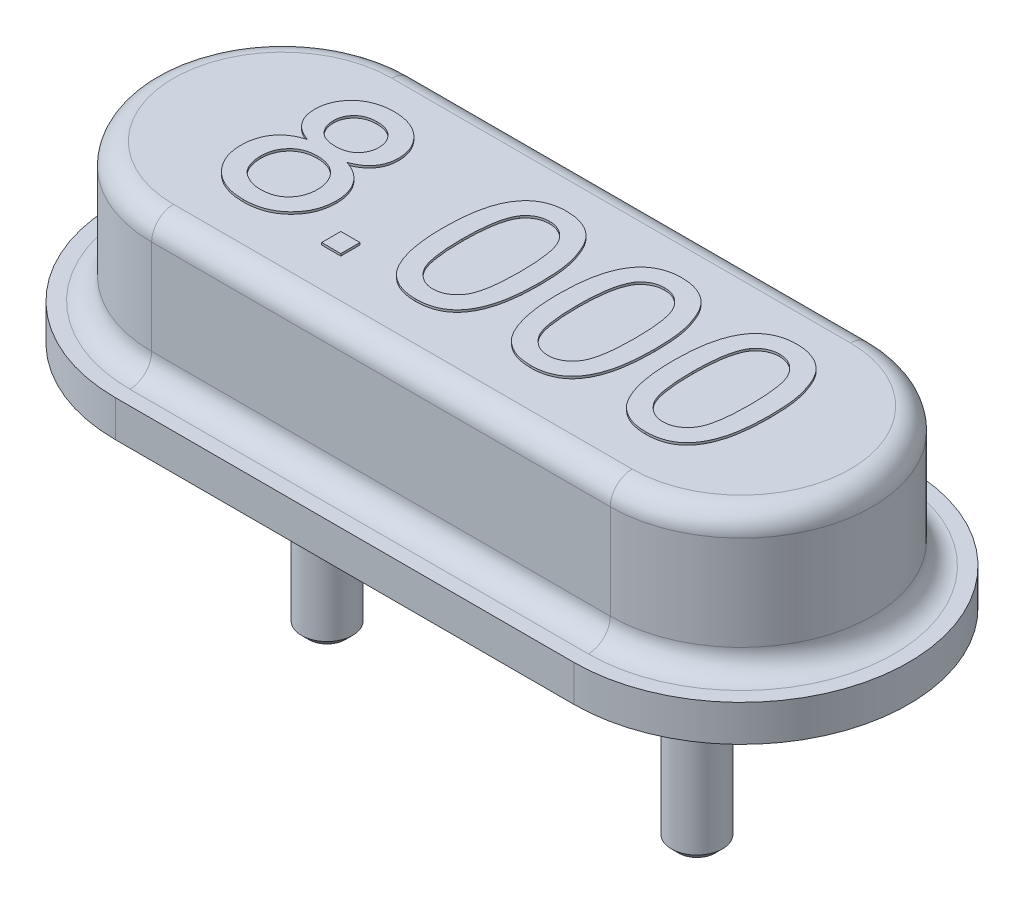
from build123d import *

# Parameters (mm, degrees)
BOSS_EXTRUDE1_DEPTH = 0.5
BOSS_EXTRUDE2_DEPTH = 1.9
FILLET1_R           = 0.3
SKETCH3_W           = 0.263417301
SKETCH3_H           = 0.263417301
BOSS_EXTRUDE3_DEPTH = 0.03
SKETCH4_R           = 0.35
BOSS_EXTRUDE4_DEPTH = 3.1
CHAMFER1_SIZE       = 0.1


with BuildPart() as part:
    # Sketch1 → Boss-Extrude1 (new body)
    with BuildSketch(Plane(origin=(0, 0, 0), x_dir=(1, 0, 0), z_dir=(0, 1, 0))):
        with BuildLine():
            Line((-3.15, 2.3), (3.15, 2.3))
            ThreePointArc((3.15, 2.3), (5.45, 0), (3.15, -2.3))
            Line((3.15, -2.3), (-3.15, -2.3))
            ThreePointArc((-3.15, -2.3), (-5.45, 0), (-3.15, 2.3))
        make_face()
    extrude(amount=BOSS_EXTRUDE1_DEPTH)

    # Sketch2 → Boss-Extrude2 (add)
    with BuildSketch(Plane(origin=(0, 0.5, 0), x_dir=(1, 0, 0), z_dir=(0, 1, 0))):
        with BuildLine():
            Line((-3.15, -1.8), (3.15, -1.8))
            ThreePointArc((3.15, -1.8), (4.95, 0), (3.15, 1.8))
            Line((3.15, 1.8), (-3.15, 1.8))
            ThreePointArc((-3.15, 1.8), (-4.95, 0), (-3.15, -1.8))
        make_face()
    extrude(amount=BOSS_EXTRUDE2_DEPTH)

    # Fillet1
    fillet1_edges = [part.edges().sort_by_distance(p)[0] for p in [
        (-4.95, 0.5, 0),
        (0, 0.5, 1.8),
        (4.95, 0.5, 0),
        (0, 0.5, -1.8),
        (-4.95, 2.4, 0),
        (0, 2.4, 1.8),
        (4.95, 2.4, 0),
        (0, 2.4, -1.8),
    ]]
    fillet(fillet1_edges, radius=FILLET1_R)

    # Sketch3 → Boss-Extrude3 (add)
    # profile 1 of 5: a face of its own
    with BuildSketch(Plane(origin=(0, 2.4, 0), x_dir=(1, 0, 0), z_dir=(0, 1, 0))):
        with BuildLine():
            add(Edge.make_bspline(
                [(-2.969967632, 0.159673879), (-2.994961282, 0.169451537), (-3.042882398, 0.188198548), (-3.107515629, 0.225716596), (-3.162217327, 0.268876169), (-3.206315829, 0.318718033), (-3.239926905, 0.374211819), (-3.264128208, 0.434649984), (-3.278303336, 0.500369235), (-3.280168947, 0.545812404), (-3.281129319, 0.569205464)],
                knots=[0, 0, 0, 0, 1.16287356, 2.229614231, 3.228817875, 4.173350329, 5.100165549, 6.029633206, 6.985702163, 8, 8, 8, 8], degree=3))
            add(Edge.make_bspline(
                [(-3.281129319, 0.569205464), (-3.280677316, 0.587205392), (-3.279790022, 0.622539814), (-3.272123594, 0.674387095), (-3.259844705, 0.724069762), (-3.242418089, 0.77144759), (-3.220585395, 0.816910542), (-3.193036217, 0.859625717), (-3.161370148, 0.900800332), (-3.124274853, 0.938769983), (-3.083396479, 0.973546509), (-3.03911882, 1.004494201), (-2.991103064, 1.02980189), (-2.94014977, 1.05096125), (-2.886006999, 1.067526792), (-2.82848403, 1.078808849), (-2.767783646, 1.085985074), (-2.726190301, 1.08691882), (-2.704903973, 1.087396686)],
                knots=[0, 0, 0, 0, 0.994101948, 1.951453197, 2.889123786, 3.817215529, 4.736003873, 5.669743943, 6.620499649, 7.601567446, 8.596478358, 9.582687259, 10.579761808, 11.589151689, 12.62747492, 13.702346593, 14.8241243, 16, 16, 16, 16], degree=3))
            add(Edge.make_bspline(
                [(-2.704903973, 1.087396686), (-2.683482006, 1.086913969), (-2.641754433, 1.085973689), (-2.580731559, 1.078893885), (-2.522845583, 1.067027692), (-2.468130585, 1.05019255), (-2.416500306, 1.028667809), (-2.368294006, 1.002211076), (-2.323015432, 0.971258707), (-2.281821888, 0.935441584), (-2.244340673, 0.896555837), (-2.211866741, 0.85489604), (-2.184014883, 0.811434295), (-2.160999507, 0.765906564), (-2.143972645, 0.717794407), (-2.130994354, 0.66800428), (-2.123466343, 0.615944578), (-2.122556621, 0.580616651), (-2.122093194, 0.562620032)],
                knots=[0, 0, 0, 0, 1.171211919, 2.281388661, 3.353996503, 4.398126828, 5.406889753, 6.407389155, 7.400009931, 8.40008733, 9.387021643, 10.349004252, 11.283445052, 12.206096336, 13.131640667, 14.068727932, 15.016178647, 16, 16, 16, 16], degree=3))
            add(Edge.make_bspline(
                [(-2.122093194, 0.562620032), (-2.122846017, 0.54003323), (-2.124322162, 0.49574476), (-2.139364737, 0.431902562), (-2.162809877, 0.37230267), (-2.196695179, 0.318080956), (-2.239609654, 0.268677429), (-2.292863095, 0.225730401), (-2.355646752, 0.188270988), (-2.402357935, 0.169462849), (-2.426669448, 0.159673879)],
                knots=[0, 0, 0, 0, 0.998680737, 1.958225066, 2.887911823, 3.823713378, 4.77537694, 5.772726054, 6.840782926, 8, 8, 8, 8], degree=3))
            add(Edge.make_bspline(
                [(-2.426669448, 0.159673879), (-2.411330462, 0.15446702), (-2.381272702, 0.144263835), (-2.338779999, 0.124425699), (-2.298774395, 0.103035479), (-2.261030296, 0.079880553), (-2.226940929, 0.053238945), (-2.195368973, 0.024685861), (-2.16644717, -0.006181066), (-2.140570561, -0.039624364), (-2.11746802, -0.074942114), (-2.09769041, -0.112220423), (-2.080893667, -0.150928684), (-2.066538591, -0.191246393), (-2.056053343, -0.233457543), (-2.048716956, -0.277368153), (-2.044062225, -0.322746798), (-2.043402857, -0.353566983), (-2.043068004, -0.369218671)],
                knots=[0, 0, 0, 0, 1.104208047, 2.163768705, 3.193778962, 4.198696312, 5.179575955, 6.14024585, 7.100368562, 8.060719304, 9.021161243, 9.975749006, 10.935506756, 11.897452199, 12.89163552, 13.897859372, 14.932451246, 16, 16, 16, 16], degree=3))
            add(Edge.make_bspline(
                [(-2.043068004, -0.369218671), (-2.04359149, -0.390790937), (-2.044622796, -0.433289945), (-2.053684181, -0.495673501), (-2.067394456, -0.555601419), (-2.087385621, -0.612820541), (-2.112919306, -0.667371316), (-2.144504782, -0.719174531), (-2.181831712, -0.768176896), (-2.223799017, -0.814530726), (-2.270718438, -0.856432581), (-2.321476561, -0.893357361), (-2.376263836, -0.924286572), (-2.434415507, -0.949895847), (-2.496210023, -0.969742941), (-2.561567952, -0.983640114), (-2.630467546, -0.99191527), (-2.677578954, -0.993030894), (-2.701611256, -0.993599992)],
                knots=[0, 0, 0, 0, 1.017598406, 2.004746413, 2.969099523, 3.915171376, 4.859468899, 5.806714415, 6.772805022, 7.762836953, 8.753334612, 9.736396794, 10.719437652, 11.716790048, 12.730404696, 13.776887535, 14.865953843, 16, 16, 16, 16], degree=3))
            add(Edge.make_bspline(
                [(-2.701611256, -0.993599992), (-2.725641155, -0.993018629), (-2.772747851, -0.991878962), (-2.841710394, -0.98377298), (-2.906974813, -0.96924581), (-2.968688981, -0.949378542), (-3.027187678, -0.924462641), (-3.081607005, -0.892836516), (-3.132696679, -0.855958518), (-3.179648725, -0.813797488), (-3.22196463, -0.767448602), (-3.258799509, -0.717722548), (-3.290197479, -0.665384594), (-3.316037327, -0.610139698), (-3.335733183, -0.551987357), (-3.349555969, -0.491145896), (-3.358633755, -0.427661806), (-3.359640448, -0.384342403), (-3.360154509, -0.362221649)],
                knots=[0, 0, 0, 0, 1.127066097, 2.209429196, 3.250843736, 4.258219581, 5.246860502, 6.227045772, 7.204057202, 8.19754525, 9.181483529, 10.142920909, 11.095356922, 12.039670968, 12.998174893, 13.969127444, 14.962948905, 16, 16, 16, 16], degree=3))
            add(Edge.make_bspline(
                [(-3.360154509, -0.362221649), (-3.359797198, -0.345751101), (-3.359096092, -0.313433035), (-3.354813271, -0.266031228), (-3.346277693, -0.220852323), (-3.335283324, -0.177630082), (-3.321323915, -0.136256374), (-3.304102328, -0.097056107), (-3.283208106, -0.060124024), (-3.259470899, -0.02521981), (-3.232591172, 0.007411496), (-3.203004583, 0.037484133), (-3.170603658, 0.064656047), (-3.136116506, 0.089720845), (-3.098097548, 0.110905518), (-3.057960697, 0.130346402), (-3.015015894, 0.146925871), (-2.985134106, 0.155381986), (-2.969967632, 0.159673879)],
                knots=[0, 0, 0, 0, 1.117345089, 2.192424383, 3.22371675, 4.232639188, 5.215561493, 6.182180952, 7.132172269, 8.089790513, 9.041830748, 9.996006267, 10.94686322, 11.907506267, 12.882866327, 13.894317773, 14.931262935, 16, 16, 16, 16], degree=3))
        make_face()
        with BuildLine():
            add(Edge.make_bspline(
                [(-3.017712018, 0.567970696), (-3.016930198, 0.547000832), (-3.015419376, 0.506477752), (-2.998989022, 0.448917685), (-2.973296718, 0.397212604), (-2.943176999, 0.359717276), (-2.914299754, 0.33416977), (-2.890197716, 0.317112608), (-2.863858849, 0.302631421), (-2.83509234, 0.29137573), (-2.804594916, 0.281403888), (-2.771314764, 0.275830354), (-2.736034113, 0.271299402), (-2.711643777, 0.270971255), (-2.699141719, 0.270803053)],
                knots=[0, 0, 0, 0, 1.528727296, 2.954179336, 4.335216052, 5.725683216, 6.435919001, 7.148062981, 7.879427438, 8.626027458, 9.402978632, 10.2190538, 11.08711833, 12, 12, 12, 12], degree=3))
            add(Edge.make_bspline(
                [(-2.699141719, 0.270803053), (-2.686915633, 0.27097747), (-2.663075435, 0.271317575), (-2.628589388, 0.275756155), (-2.596000195, 0.281684296), (-2.565789426, 0.290667482), (-2.537608302, 0.302348243), (-2.511915175, 0.316747739), (-2.487941183, 0.333296892), (-2.459912244, 0.35903958), (-2.42983409, 0.395221674), (-2.404055684, 0.444617015), (-2.387991679, 0.498658452), (-2.386352076, 0.536301463), (-2.385510495, 0.55562301)],
                knots=[0, 0, 0, 0, 0.922112375, 1.798068639, 2.620552757, 3.419964248, 4.17189205, 4.918165909, 5.639229138, 6.36503528, 7.785020832, 9.165298717, 10.544993853, 12, 12, 12, 12], degree=3))
            add(Edge.make_bspline(
                [(-2.385510495, 0.55562301), (-2.386524482, 0.575619983), (-2.388508593, 0.614748881), (-2.404533359, 0.670920178), (-2.431512455, 0.721794597), (-2.462332333, 0.758947465), (-2.490857103, 0.78586253), (-2.515261498, 0.802995772), (-2.541496314, 0.817577676), (-2.5696614, 0.829485764), (-2.599797484, 0.839089761), (-2.631986202, 0.845390446), (-2.666092297, 0.849809338), (-2.68952248, 0.850146933), (-2.701611256, 0.850321115)],
                knots=[0, 0, 0, 0, 1.480633456, 2.897216237, 4.289382554, 5.720567045, 6.454675042, 7.191244726, 7.924224627, 8.676083236, 9.454506446, 10.26432127, 11.104478565, 12, 12, 12, 12], degree=3))
            add(Edge.make_bspline(
                [(-2.701611256, 0.850321115), (-2.713701378, 0.850152566), (-2.737270479, 0.849823989), (-2.77159897, 0.845272495), (-2.80409274, 0.839555911), (-2.834452014, 0.830381852), (-2.862550599, 0.818393489), (-2.888681984, 0.803803394), (-2.913040139, 0.787107794), (-2.941765315, 0.761392915), (-2.971850204, 0.725210002), (-2.998354146, 0.676603562), (-3.014734439, 0.623606139), (-3.016707198, 0.586745545), (-3.017712018, 0.567970696)],
                knots=[0, 0, 0, 0, 0.914830409, 1.783417199, 2.618873138, 3.411020283, 4.179090249, 4.927874451, 5.674348476, 6.410336976, 7.841713217, 9.213201474, 10.580551314, 12, 12, 12, 12], degree=3))
        make_face(mode=Mode.SUBTRACT)
        with BuildLine():
            add(Edge.make_bspline(
                [(-3.096737208, -0.357282574), (-3.0962817, -0.374184871), (-3.095369484, -0.408033988), (-3.087367388, -0.4583071), (-3.07378949, -0.507644034), (-3.056387048, -0.556091393), (-3.031839823, -0.601693757), (-2.999287441, -0.642397223), (-2.958440299, -0.676618242), (-2.91179063, -0.705529458), (-2.860883846, -0.728285071), (-2.807837489, -0.744169263), (-2.754020657, -0.754664743), (-2.717711169, -0.755904458), (-2.699553309, -0.756524421)],
                knots=[0, 0, 0, 0, 0.957879255, 1.91828174, 2.876792425, 3.856375228, 4.831004356, 5.799187063, 6.79220414, 7.836856316, 8.902268238, 9.943090861, 10.971368942, 12, 12, 12, 12], degree=3))
            add(Edge.make_bspline(
                [(-2.699553309, -0.756524421), (-2.684580195, -0.756270788), (-2.655491704, -0.75577805), (-2.613089792, -0.750147464), (-2.573137604, -0.741604023), (-2.535452101, -0.729889566), (-2.500587973, -0.713863412), (-2.467977471, -0.69513232), (-2.437954158, -0.672494362), (-2.410526534, -0.646658736), (-2.385973949, -0.618079693), (-2.364941554, -0.58724915), (-2.346594748, -0.555034141), (-2.33161542, -0.520739415), (-2.320782951, -0.484294255), (-2.312424172, -0.44635621), (-2.307381567, -0.40653397), (-2.306788389, -0.379385734), (-2.306485305, -0.365514365)],
                knots=[0, 0, 0, 0, 1.149387474, 2.232932207, 3.278773642, 4.285224938, 5.256757121, 6.220082341, 7.168479488, 8.137608443, 9.109140627, 10.056190326, 10.999892409, 11.953252726, 12.923240661, 13.915357002, 14.934853301, 16, 16, 16, 16], degree=3))
            add(Edge.make_bspline(
                [(-2.306485305, -0.365514365), (-2.306798042, -0.351370717), (-2.30741033, -0.323679707), (-2.312324786, -0.282983451), (-2.321152272, -0.244377942), (-2.332504456, -0.207279964), (-2.347889911, -0.172334915), (-2.366357996, -0.139041726), (-2.388973898, -0.10827793), (-2.413774038, -0.078999091), (-2.441839491, -0.052494974), (-2.472832536, -0.029639473), (-2.505770933, -0.009454195), (-2.541651098, 0.006029618), (-2.579682542, 0.018432504), (-2.620045946, 0.027444631), (-2.662905885, 0.032953504), (-2.692264752, 0.033464507), (-2.70737351, 0.033727482)],
                knots=[0, 0, 0, 0, 1.065858887, 2.086781919, 3.082735321, 4.047496077, 5.006086125, 5.955204095, 6.910833714, 7.878747924, 8.844339535, 9.812198509, 10.776903849, 11.749116737, 12.749729282, 13.788304076, 14.861809717, 16, 16, 16, 16], degree=3))
            add(Edge.make_bspline(
                [(-2.70737351, 0.033727482), (-2.722071979, 0.03346189), (-2.750885556, 0.032941249), (-2.792743718, 0.02740117), (-2.832370538, 0.018893448), (-2.869417377, 0.006441263), (-2.904347434, -0.009119007), (-2.936521851, -0.028684933), (-2.966514618, -0.051395391), (-2.993409562, -0.077791978), (-3.017675771, -0.106465848), (-3.038656508, -0.137204149), (-3.057190862, -0.169293844), (-3.071256192, -0.203787912), (-3.083161235, -0.239571225), (-3.09060377, -0.277338296), (-3.095894482, -0.316660026), (-3.096452194, -0.343543813), (-3.096737208, -0.357282574)],
                knots=[0, 0, 0, 0, 1.135239447, 2.225422834, 3.256957183, 4.262780498, 5.240265059, 6.205773948, 7.16638056, 8.141101257, 9.111719309, 10.064571387, 11.014055337, 11.969087385, 12.938082716, 13.92369833, 14.938921288, 16, 16, 16, 16], degree=3))
        make_face(mode=Mode.SUBTRACT)
    # profile 2 of 5: a face of its own
    with BuildSketch(Plane(origin=(0, 2.4, 0), x_dir=(1, 0, 0), z_dir=(0, 1, 0))):
        with Locations((-1.516233402, -0.835549612)):
            Rectangle(SKETCH3_W, SKETCH3_H)
    # profile 3 of 5: a face of its own
    with BuildSketch(Plane(origin=(0, 2.4, 0), x_dir=(1, 0, 0), z_dir=(0, 1, 0))):
        with BuildLine():
            add(Edge.make_bspline(
                [(-0.9893988, 0.046075168), (-0.989133407, 0.075438073), (-0.988613614, 0.132947639), (-0.985389506, 0.217094466), (-0.979760475, 0.297005223), (-0.971357882, 0.372610512), (-0.961407637, 0.444080988), (-0.948472255, 0.511314656), (-0.933918071, 0.574462366), (-0.916455662, 0.633458296), (-0.89727019, 0.688809703), (-0.875503661, 0.740427793), (-0.851013363, 0.788257836), (-0.825002842, 0.832795859), (-0.79610285, 0.87334911), (-0.766057735, 0.911055681), (-0.732683995, 0.944532724), (-0.697369382, 0.974641607), (-0.65959388, 1.001210941), (-0.619557359, 1.024137072), (-0.577413868, 1.044379193), (-0.532360199, 1.059617456), (-0.485331657, 1.072039871), (-0.435966241, 1.08117795), (-0.384209552, 1.086565156), (-0.34884113, 1.087116378), (-0.330855547, 1.087396686)],
                knots=[0, 0, 0, 0, 1.514747001, 2.966751498, 4.343369068, 5.64627492, 6.890416844, 8.064737671, 9.177176366, 10.232018008, 11.237056675, 12.19799043, 13.119080079, 14.007588942, 14.855863561, 15.685992447, 16.491747269, 17.290132607, 18.077525251, 18.870243746, 19.668095604, 20.485086593, 21.319398728, 22.175900658, 23.072407314, 24, 24, 24, 24], degree=3))
            add(Edge.make_bspline(
                [(-0.330855547, 1.087396686), (-0.304468358, 1.086620921), (-0.252629667, 1.0850969), (-0.17694491, 1.072667263), (-0.105616904, 1.051404453), (-0.038691991, 1.022720004), (0.022685758, 0.986285233), (0.077498675, 0.941993219), (0.125155514, 0.890309017), (0.165136174, 0.830620189), (0.200083261, 0.764573349), (0.231129487, 0.691872055), (0.259194373, 0.612597778), (0.279109827, 0.541636234), (0.293315505, 0.48037971), (0.302718534, 0.429857063), (0.310524934, 0.375342842), (0.316505691, 0.316968931), (0.321412761, 0.254800804), (0.325202266, 0.188799752), (0.327125828, 0.118800816), (0.327496902, 0.070771508), (0.327687705, 0.046075168)],
                knots=[0, 0, 0, 0, 1.134486744, 2.228744715, 3.287356444, 4.328707449, 5.352829806, 6.347195599, 7.349461267, 8.364207941, 9.428085653, 10.559314403, 11.761222316, 13.04268526, 13.726896727, 14.465273606, 15.252205015, 16.094778733, 16.988606776, 17.934225168, 18.937792761, 20, 20, 20, 20], degree=3))
            add(Edge.make_bspline(
                [(0.327687705, 0.046075168), (0.327417341, 0.016850185), (0.326889131, -0.040246573), (0.323751415, -0.123718684), (0.317783196, -0.203026553), (0.310439192, -0.278351852), (0.299329254, -0.349493498), (0.287357693, -0.416753752), (0.27255183, -0.479827194), (0.255276864, -0.538741467), (0.235821329, -0.593808089), (0.214485324, -0.645443222), (0.19085365, -0.693611584), (0.164222939, -0.737843365), (0.135811667, -0.778725668), (0.105411751, -0.81641185), (0.072378678, -0.8503595), (0.036745826, -0.880378072), (-0.000764445, -0.907418576), (-0.040898302, -0.930571057), (-0.083480087, -0.949752486), (-0.128225294, -0.966151654), (-0.175587927, -0.978168003), (-0.22519449, -0.98736633), (-0.27722776, -0.992782971), (-0.312732984, -0.993323894), (-0.330855547, -0.993599992)],
                knots=[0, 0, 0, 0, 1.508974709, 2.94807912, 4.311757619, 5.615040294, 6.854280449, 8.028314546, 9.141715822, 10.197470207, 11.196696834, 12.155719058, 13.080757287, 13.963948316, 14.818758719, 15.649605906, 16.461113142, 17.260189315, 18.052359509, 18.845763934, 19.647754795, 20.461145776, 21.303032214, 22.167241874, 23.064524267, 24, 24, 24, 24], degree=3))
            add(Edge.make_bspline(
                [(-0.330855547, -0.993599992), (-0.354616329, -0.992922214), (-0.400943314, -0.991600735), (-0.46860046, -0.982622094), (-0.5321003, -0.966819265), (-0.591978419, -0.945625443), (-0.64756177, -0.917277486), (-0.699115743, -0.882786661), (-0.747676277, -0.842955432), (-0.775630673, -0.811529507), (-0.789777876, -0.795625427)],
                knots=[0, 0, 0, 0, 1.10322584, 2.150986741, 3.161425019, 4.136713905, 5.093944212, 6.049774532, 7.013026876, 8, 8, 8, 8], degree=3))
            add(Edge.make_bspline(
                [(-0.789777876, -0.795625427), (-0.806061633, -0.772135868), (-0.839639437, -0.723699394), (-0.878939345, -0.641110712), (-0.913995559, -0.550192168), (-0.941508259, -0.449159952), (-0.963057562, -0.338818167), (-0.978621539, -0.218950297), (-0.987429217, -0.089608129), (-0.988727452, -0.000173588), (-0.9893988, 0.046075168)],
                knots=[0, 0, 0, 0, 0.779365345, 1.607084704, 2.489375761, 3.438383567, 4.461919411, 5.557722155, 6.737039282, 8, 8, 8, 8], degree=3))
        make_face()
        with BuildLine():
            add(Edge.make_bspline(
                [(-0.725981499, 0.046898347), (-0.725719946, 0.007379859), (-0.725219277, -0.068267268), (-0.719988499, -0.17634224), (-0.71098393, -0.273840617), (-0.699079302, -0.360627407), (-0.683360373, -0.436820005), (-0.663623398, -0.502224249), (-0.641375133, -0.557625138), (-0.613843327, -0.602336022), (-0.58369904, -0.638781914), (-0.552577123, -0.670126561), (-0.519745387, -0.696768792), (-0.485418053, -0.71898298), (-0.449062509, -0.735802104), (-0.411076296, -0.747992642), (-0.371451148, -0.755008109), (-0.344464623, -0.7560161), (-0.330855547, -0.756524421)],
                knots=[0, 0, 0, 0, 1.89448813, 3.626469325, 5.185477471, 6.587276848, 7.82441448, 8.910550357, 9.859733512, 10.6775885, 11.416198291, 12.123144072, 12.791880183, 13.439617036, 14.078171869, 14.70637855, 15.347637704, 16, 16, 16, 16], degree=3))
            add(Edge.make_bspline(
                [(-0.330855547, -0.756524421), (-0.31724988, -0.756004993), (-0.290270112, -0.754974978), (-0.250553407, -0.748114208), (-0.21271499, -0.735296109), (-0.176413651, -0.718536391), (-0.141836816, -0.696828531), (-0.109166326, -0.670085666), (-0.077880466, -0.638759631), (-0.047871586, -0.601890121), (-0.020549534, -0.556972524), (0.002116081, -0.501616764), (0.021545466, -0.436097978), (0.037350649, -0.3599442), (0.049304385, -0.273294627), (0.058254511, -0.176066666), (0.063520295, -0.068130751), (0.064012701, 0.007379681), (0.064270404, 0.046898347)],
                knots=[0, 0, 0, 0, 0.652509534, 1.29391342, 1.924290653, 2.562989607, 3.207355802, 3.876242846, 4.583348185, 5.32723334, 6.150888545, 7.094226006, 8.186903555, 9.424320409, 10.81992305, 12.379283064, 14.105084285, 16, 16, 16, 16], degree=3))
            add(Edge.make_bspline(
                [(0.064270404, 0.046898347), (0.064020953, 0.085594758), (0.063543013, 0.159735616), (0.058141418, 0.265728521), (0.049676632, 0.361590428), (0.038098151, 0.447409712), (0.022710351, 0.523093205), (0.004047048, 0.588802026), (-0.018193067, 0.644396042), (-0.044636484, 0.690433694), (-0.074073299, 0.728197058), (-0.104822843, 0.760884536), (-0.137653857, 0.788684171), (-0.173148008, 0.810985448), (-0.210161254, 0.828977289), (-0.249544064, 0.841359732), (-0.290909336, 0.848967118), (-0.319297786, 0.849864626), (-0.333736674, 0.850321115)],
                knots=[0, 0, 0, 0, 1.850066095, 3.544656626, 5.0727657, 6.45041401, 7.682899467, 8.762389858, 9.712573485, 10.538438529, 11.291566246, 11.996865408, 12.681389046, 13.341983376, 13.996294293, 14.643563182, 15.31009126, 16, 16, 16, 16], degree=3))
            add(Edge.make_bspline(
                [(-0.333736674, 0.850321115), (-0.347344895, 0.849963953), (-0.374178562, 0.849259675), (-0.413466566, 0.84253735), (-0.450699345, 0.831296125), (-0.486303467, 0.816068793), (-0.519390095, 0.795575812), (-0.551271361, 0.771648799), (-0.580454071, 0.742496403), (-0.598039316, 0.720702528), (-0.607032124, 0.709557495)],
                knots=[0, 0, 0, 0, 1.021318143, 2.013908504, 2.982026795, 3.937174072, 4.91255697, 5.897578595, 6.924855925, 8, 8, 8, 8], degree=3))
            add(Edge.make_bspline(
                [(-0.607032124, 0.709557495), (-0.616822548, 0.693188893), (-0.637497863, 0.658621854), (-0.660632338, 0.598542914), (-0.681068419, 0.529884122), (-0.697894089, 0.451589112), (-0.710066281, 0.363792191), (-0.719675755, 0.266595319), (-0.72466752, 0.159862798), (-0.725531421, 0.085592072), (-0.725981499, 0.046898347)],
                knots=[0, 0, 0, 0, 0.671104906, 1.417232262, 2.260109084, 3.195198885, 4.23592645, 5.382417421, 6.636286093, 8, 8, 8, 8], degree=3))
        make_face(mode=Mode.SUBTRACT)
    # profile 4 of 5: a face of its own
    with BuildSketch(Plane(origin=(0, 2.4, 0), x_dir=(1, 0, 0), z_dir=(0, 1, 0))):
        with BuildLine():
            add(Edge.make_bspline(
                [(0.591105006, 0.046075168), (0.591370399, 0.075438073), (0.591890192, 0.132947639), (0.5951143, 0.217094466), (0.600743331, 0.297005223), (0.609145925, 0.372610512), (0.61909617, 0.444080988), (0.632031551, 0.511314656), (0.646585735, 0.574462366), (0.664048144, 0.633458296), (0.683233616, 0.688809703), (0.705000145, 0.740427793), (0.729490443, 0.788257836), (0.755500964, 0.832795859), (0.784400956, 0.87334911), (0.814446072, 0.911055681), (0.847819812, 0.944532724), (0.883134424, 0.974641607), (0.920909926, 1.001210941), (0.960946447, 1.024137072), (1.003089938, 1.044379193), (1.048143607, 1.059617456), (1.095172149, 1.072039871), (1.144537565, 1.08117795), (1.196294254, 1.086565156), (1.231662676, 1.087116378), (1.249648259, 1.087396686)],
                knots=[0, 0, 0, 0, 1.514747001, 2.966751498, 4.343369068, 5.64627492, 6.890416844, 8.064737671, 9.177176366, 10.232018008, 11.237056675, 12.19799043, 13.119080079, 14.007588942, 14.855863561, 15.685992447, 16.491747269, 17.290132607, 18.077525251, 18.870243746, 19.668095604, 20.485086593, 21.319398728, 22.175900658, 23.072407314, 24, 24, 24, 24], degree=3))
            add(Edge.make_bspline(
                [(1.249648259, 1.087396686), (1.276035448, 1.086620921), (1.327874139, 1.0850969), (1.403558897, 1.072667263), (1.474886902, 1.051404453), (1.541811815, 1.022720004), (1.603189564, 0.986285233), (1.658002481, 0.941993219), (1.70565932, 0.890309017), (1.74563998, 0.830620189), (1.780587068, 0.764573349), (1.811633293, 0.691872055), (1.839698179, 0.612597778), (1.859613633, 0.541636234), (1.873819311, 0.48037971), (1.88322234, 0.429857063), (1.89102874, 0.375342842), (1.897009497, 0.316968931), (1.901916567, 0.254800804), (1.905706072, 0.188799752), (1.907629634, 0.118800816), (1.908000708, 0.070771508), (1.908191511, 0.046075168)],
                knots=[0, 0, 0, 0, 1.134486744, 2.228744715, 3.287356444, 4.328707449, 5.352829806, 6.347195599, 7.349461267, 8.364207941, 9.428085653, 10.559314403, 11.761222316, 13.04268526, 13.726896727, 14.465273606, 15.252205015, 16.094778733, 16.988606776, 17.934225168, 18.937792761, 20, 20, 20, 20], degree=3))
            add(Edge.make_bspline(
                [(1.908191511, 0.046075168), (1.907921147, 0.016850185), (1.907392937, -0.040246573), (1.904255221, -0.123718684), (1.898287002, -0.203026553), (1.890942999, -0.278351852), (1.87983306, -0.349493498), (1.8678615, -0.416753752), (1.853055636, -0.479827194), (1.83578067, -0.538741467), (1.816325135, -0.593808089), (1.79498913, -0.645443222), (1.771357456, -0.693611584), (1.744726746, -0.737843365), (1.716315473, -0.778725668), (1.685915557, -0.81641185), (1.652882484, -0.8503595), (1.617249632, -0.880378072), (1.579739361, -0.907418576), (1.539605504, -0.930571057), (1.497023719, -0.949752486), (1.452278512, -0.966151654), (1.404915879, -0.978168003), (1.355309316, -0.98736633), (1.303276046, -0.992782971), (1.267770822, -0.993323894), (1.249648259, -0.993599992)],
                knots=[0, 0, 0, 0, 1.508974709, 2.94807912, 4.311757619, 5.615040294, 6.854280449, 8.028314546, 9.141715822, 10.197470207, 11.196696834, 12.155719058, 13.080757287, 13.963948316, 14.818758719, 15.649605906, 16.461113142, 17.260189315, 18.052359509, 18.845763934, 19.647754795, 20.461145776, 21.303032214, 22.167241874, 23.064524267, 24, 24, 24, 24], degree=3))
            add(Edge.make_bspline(
                [(1.249648259, -0.993599992), (1.225887477, -0.992922214), (1.179560492, -0.991600735), (1.111903346, -0.982622094), (1.048403506, -0.966819265), (0.988525387, -0.945625443), (0.932942036, -0.917277486), (0.881388063, -0.882786661), (0.832827529, -0.842955432), (0.804873133, -0.811529507), (0.79072593, -0.795625427)],
                knots=[0, 0, 0, 0, 1.10322584, 2.150986741, 3.161425019, 4.136713905, 5.093944212, 6.049774532, 7.013026876, 8, 8, 8, 8], degree=3))
            add(Edge.make_bspline(
                [(0.79072593, -0.795625427), (0.774442173, -0.772135868), (0.740864369, -0.723699394), (0.701564461, -0.641110712), (0.666508247, -0.550192168), (0.638995547, -0.449159952), (0.617446244, -0.338818167), (0.601882267, -0.218950297), (0.593074589, -0.089608129), (0.591776354, -0.000173588), (0.591105006, 0.046075168)],
                knots=[0, 0, 0, 0, 0.779365345, 1.607084704, 2.489375761, 3.438383567, 4.461919411, 5.557722155, 6.737039282, 8, 8, 8, 8], degree=3))
        make_face()
        with BuildLine():
            add(Edge.make_bspline(
                [(0.854522307, 0.046898347), (0.85478386, 0.007379859), (0.855284529, -0.068267268), (0.860515307, -0.17634224), (0.869519876, -0.273840617), (0.881424504, -0.360627407), (0.897143433, -0.436820005), (0.916880408, -0.502224249), (0.939128673, -0.557625138), (0.96666048, -0.602336022), (0.996804767, -0.638781914), (1.027926683, -0.670126561), (1.060758419, -0.696768792), (1.095085753, -0.71898298), (1.131441298, -0.735802104), (1.169427511, -0.747992642), (1.209052658, -0.755008109), (1.236039183, -0.7560161), (1.249648259, -0.756524421)],
                knots=[0, 0, 0, 0, 1.89448813, 3.626469325, 5.185477471, 6.587276848, 7.82441448, 8.910550357, 9.859733512, 10.6775885, 11.416198291, 12.123144072, 12.791880183, 13.439617036, 14.078171869, 14.70637855, 15.347637704, 16, 16, 16, 16], degree=3))
            add(Edge.make_bspline(
                [(1.249648259, -0.756524421), (1.263253926, -0.756004993), (1.290233694, -0.754974978), (1.329950399, -0.748114208), (1.367788816, -0.735296109), (1.404090155, -0.718536391), (1.43866699, -0.696828531), (1.47133748, -0.670085666), (1.50262334, -0.638759631), (1.53263222, -0.601890121), (1.559954272, -0.556972524), (1.582619887, -0.501616764), (1.602049273, -0.436097978), (1.617854455, -0.3599442), (1.629808191, -0.273294627), (1.638758318, -0.176066666), (1.644024101, -0.068130751), (1.644516508, 0.007379681), (1.64477421, 0.046898347)],
                knots=[0, 0, 0, 0, 0.652509534, 1.29391342, 1.924290653, 2.562989607, 3.207355802, 3.876242846, 4.583348185, 5.32723334, 6.150888545, 7.094226006, 8.186903555, 9.424320409, 10.81992305, 12.379283064, 14.105084285, 16, 16, 16, 16], degree=3))
            add(Edge.make_bspline(
                [(1.64477421, 0.046898347), (1.644524759, 0.085594758), (1.644046819, 0.159735616), (1.638645224, 0.265728521), (1.630180438, 0.361590428), (1.618601957, 0.447409712), (1.603214157, 0.523093205), (1.584550855, 0.588802026), (1.562310739, 0.644396042), (1.535867322, 0.690433694), (1.506430507, 0.728197058), (1.475680963, 0.760884536), (1.442849949, 0.788684171), (1.407355798, 0.810985448), (1.370342552, 0.828977289), (1.330959742, 0.841359732), (1.28959447, 0.848967118), (1.26120602, 0.849864626), (1.246767132, 0.850321115)],
                knots=[0, 0, 0, 0, 1.850066095, 3.544656626, 5.0727657, 6.45041401, 7.682899467, 8.762389858, 9.712573485, 10.538438529, 11.291566246, 11.996865408, 12.681389046, 13.341983376, 13.996294293, 14.643563182, 15.31009126, 16, 16, 16, 16], degree=3))
            add(Edge.make_bspline(
                [(1.246767132, 0.850321115), (1.233158911, 0.849963953), (1.206325244, 0.849259675), (1.167037241, 0.84253735), (1.129804461, 0.831296125), (1.094200339, 0.816068793), (1.061113711, 0.795575812), (1.029232445, 0.771648799), (1.000049735, 0.742496403), (0.98246449, 0.720702528), (0.973471682, 0.709557495)],
                knots=[0, 0, 0, 0, 1.021318143, 2.013908504, 2.982026795, 3.937174072, 4.91255697, 5.897578595, 6.924855925, 8, 8, 8, 8], degree=3))
            add(Edge.make_bspline(
                [(0.973471682, 0.709557495), (0.963681258, 0.693188893), (0.943005943, 0.658621854), (0.919871468, 0.598542914), (0.899435387, 0.529884122), (0.882609717, 0.451589112), (0.870437526, 0.363792191), (0.860828051, 0.266595319), (0.855836286, 0.159862798), (0.854972385, 0.085592072), (0.854522307, 0.046898347)],
                knots=[0, 0, 0, 0, 0.671104906, 1.417232262, 2.260109084, 3.195198885, 4.23592645, 5.382417421, 6.636286093, 8, 8, 8, 8], degree=3))
        make_face(mode=Mode.SUBTRACT)
    # profile 5 of 5: a face of its own
    with BuildSketch(Plane(origin=(0, 2.4, 0), x_dir=(1, 0, 0), z_dir=(0, 1, 0))):
        with BuildLine():
            add(Edge.make_bspline(
                [(2.171608812, 0.046075168), (2.171874205, 0.075438073), (2.172393998, 0.132947639), (2.175618106, 0.217094466), (2.181247137, 0.297005223), (2.189649731, 0.372610512), (2.199599976, 0.444080988), (2.212535357, 0.511314656), (2.227089541, 0.574462366), (2.244551951, 0.633458296), (2.263737422, 0.688809703), (2.285503951, 0.740427793), (2.309994249, 0.788257836), (2.336004771, 0.832795859), (2.364904762, 0.87334911), (2.394949878, 0.911055681), (2.428323618, 0.944532724), (2.46363823, 0.974641607), (2.501413732, 1.001210941), (2.541450253, 1.024137072), (2.583593744, 1.044379193), (2.628647413, 1.059617456), (2.675675955, 1.072039871), (2.725041371, 1.08117795), (2.77679806, 1.086565156), (2.812166482, 1.087116378), (2.830152065, 1.087396686)],
                knots=[0, 0, 0, 0, 1.514747001, 2.966751498, 4.343369068, 5.64627492, 6.890416844, 8.064737671, 9.177176366, 10.232018008, 11.237056675, 12.19799043, 13.119080079, 14.007588942, 14.855863561, 15.685992447, 16.491747269, 17.290132607, 18.077525251, 18.870243746, 19.668095604, 20.485086593, 21.319398728, 22.175900658, 23.072407314, 24, 24, 24, 24], degree=3))
            add(Edge.make_bspline(
                [(2.830152065, 1.087396686), (2.856539254, 1.086620921), (2.908377945, 1.0850969), (2.984062703, 1.072667263), (3.055390708, 1.051404453), (3.122315621, 1.022720004), (3.18369337, 0.986285233), (3.238506287, 0.941993219), (3.286163126, 0.890309017), (3.326143786, 0.830620189), (3.361090874, 0.764573349), (3.392137099, 0.691872055), (3.420201985, 0.612597778), (3.44011744, 0.541636234), (3.454323117, 0.48037971), (3.463726146, 0.429857063), (3.471532546, 0.375342842), (3.477513303, 0.316968931), (3.482420373, 0.254800804), (3.486209879, 0.188799752), (3.48813344, 0.118800816), (3.488504514, 0.070771508), (3.488695317, 0.046075168)],
                knots=[0, 0, 0, 0, 1.134486744, 2.228744715, 3.287356444, 4.328707449, 5.352829806, 6.347195599, 7.349461267, 8.364207941, 9.428085653, 10.559314403, 11.761222316, 13.04268526, 13.726896727, 14.465273606, 15.252205015, 16.094778733, 16.988606776, 17.934225168, 18.937792761, 20, 20, 20, 20], degree=3))
            add(Edge.make_bspline(
                [(3.488695317, 0.046075168), (3.488424953, 0.016850185), (3.487896743, -0.040246573), (3.484759027, -0.123718684), (3.478790808, -0.203026553), (3.471446805, -0.278351852), (3.460336866, -0.349493498), (3.448365306, -0.416753752), (3.433559442, -0.479827194), (3.416284476, -0.538741467), (3.396828941, -0.593808089), (3.375492936, -0.645443222), (3.351861262, -0.693611584), (3.325230552, -0.737843365), (3.296819279, -0.778725668), (3.266419363, -0.81641185), (3.23338629, -0.8503595), (3.197753438, -0.880378072), (3.160243168, -0.907418576), (3.12010931, -0.930571057), (3.077527525, -0.949752486), (3.032782319, -0.966151654), (2.985419685, -0.978168003), (2.935813122, -0.98736633), (2.883779852, -0.992782971), (2.848274628, -0.993323894), (2.830152065, -0.993599992)],
                knots=[0, 0, 0, 0, 1.508974709, 2.94807912, 4.311757619, 5.615040294, 6.854280449, 8.028314546, 9.141715822, 10.197470207, 11.196696834, 12.155719058, 13.080757287, 13.963948316, 14.818758719, 15.649605906, 16.461113142, 17.260189315, 18.052359509, 18.845763934, 19.647754795, 20.461145776, 21.303032214, 22.167241874, 23.064524267, 24, 24, 24, 24], degree=3))
            add(Edge.make_bspline(
                [(2.830152065, -0.993599992), (2.806391283, -0.992922214), (2.760064298, -0.991600735), (2.692407152, -0.982622094), (2.628907313, -0.966819265), (2.569029193, -0.945625443), (2.513445842, -0.917277486), (2.461891869, -0.882786661), (2.413331335, -0.842955432), (2.38537694, -0.811529507), (2.371229736, -0.795625427)],
                knots=[0, 0, 0, 0, 1.10322584, 2.150986741, 3.161425019, 4.136713905, 5.093944212, 6.049774532, 7.013026876, 8, 8, 8, 8], degree=3))
            add(Edge.make_bspline(
                [(2.371229736, -0.795625427), (2.354945979, -0.772135868), (2.321368175, -0.723699394), (2.282068267, -0.641110712), (2.247012053, -0.550192168), (2.219499353, -0.449159952), (2.19795005, -0.338818167), (2.182386073, -0.218950297), (2.173578395, -0.089608129), (2.172280161, -0.000173588), (2.171608812, 0.046075168)],
                knots=[0, 0, 0, 0, 0.779365345, 1.607084704, 2.489375761, 3.438383567, 4.461919411, 5.557722155, 6.737039282, 8, 8, 8, 8], degree=3))
        make_face()
        with BuildLine():
            add(Edge.make_bspline(
                [(2.435026113, 0.046898347), (2.435287666, 0.007379859), (2.435788335, -0.068267268), (2.441019113, -0.17634224), (2.450023682, -0.273840617), (2.46192831, -0.360627407), (2.477647239, -0.436820005), (2.497384214, -0.502224249), (2.519632479, -0.557625138), (2.547164286, -0.602336022), (2.577308573, -0.638781914), (2.608430489, -0.670126561), (2.641262226, -0.696768792), (2.675589559, -0.71898298), (2.711945104, -0.735802104), (2.749931317, -0.747992642), (2.789556464, -0.755008109), (2.816542989, -0.7560161), (2.830152065, -0.756524421)],
                knots=[0, 0, 0, 0, 1.89448813, 3.626469325, 5.185477471, 6.587276848, 7.82441448, 8.910550357, 9.859733512, 10.6775885, 11.416198291, 12.123144072, 12.791880183, 13.439617036, 14.078171869, 14.70637855, 15.347637704, 16, 16, 16, 16], degree=3))
            add(Edge.make_bspline(
                [(2.830152065, -0.756524421), (2.843757733, -0.756004993), (2.870737501, -0.754974978), (2.910454205, -0.748114208), (2.948292623, -0.735296109), (2.984593961, -0.718536391), (3.019170796, -0.696828531), (3.051841286, -0.670085666), (3.083127146, -0.638759631), (3.113136026, -0.601890121), (3.140458078, -0.556972524), (3.163123694, -0.501616764), (3.182553079, -0.436097978), (3.198358261, -0.3599442), (3.210311997, -0.273294627), (3.219262124, -0.176066666), (3.224527907, -0.068130751), (3.225020314, 0.007379681), (3.225278016, 0.046898347)],
                knots=[0, 0, 0, 0, 0.652509534, 1.29391342, 1.924290653, 2.562989607, 3.207355802, 3.876242846, 4.583348185, 5.32723334, 6.150888545, 7.094226006, 8.186903555, 9.424320409, 10.81992305, 12.379283064, 14.105084285, 16, 16, 16, 16], degree=3))
            add(Edge.make_bspline(
                [(3.225278016, 0.046898347), (3.225028565, 0.085594758), (3.224550625, 0.159735616), (3.21914903, 0.265728521), (3.210684244, 0.361590428), (3.199105763, 0.447409712), (3.183717963, 0.523093205), (3.165054661, 0.588802026), (3.142814545, 0.644396042), (3.116371128, 0.690433694), (3.086934313, 0.728197058), (3.056184769, 0.760884536), (3.023353755, 0.788684171), (2.987859604, 0.810985448), (2.950846358, 0.828977289), (2.911463548, 0.841359732), (2.870098276, 0.848967118), (2.841709826, 0.849864626), (2.827270938, 0.850321115)],
                knots=[0, 0, 0, 0, 1.850066095, 3.544656626, 5.0727657, 6.45041401, 7.682899467, 8.762389858, 9.712573485, 10.538438529, 11.291566246, 11.996865408, 12.681389046, 13.341983376, 13.996294293, 14.643563182, 15.31009126, 16, 16, 16, 16], degree=3))
            add(Edge.make_bspline(
                [(2.827270938, 0.850321115), (2.813662717, 0.849963953), (2.78682905, 0.849259675), (2.747541047, 0.84253735), (2.710308267, 0.831296125), (2.674704145, 0.816068793), (2.641617517, 0.795575812), (2.609736251, 0.771648799), (2.580553541, 0.742496403), (2.562968296, 0.720702528), (2.553975488, 0.709557495)],
                knots=[0, 0, 0, 0, 1.021318143, 2.013908504, 2.982026795, 3.937174072, 4.91255697, 5.897578595, 6.924855925, 8, 8, 8, 8], degree=3))
            add(Edge.make_bspline(
                [(2.553975488, 0.709557495), (2.544185064, 0.693188893), (2.523509749, 0.658621854), (2.500375274, 0.598542914), (2.479939193, 0.529884122), (2.463113523, 0.451589112), (2.450941332, 0.363792191), (2.441331857, 0.266595319), (2.436340092, 0.159862798), (2.435476191, 0.085592072), (2.435026113, 0.046898347)],
                knots=[0, 0, 0, 0, 0.671104906, 1.417232262, 2.260109084, 3.195198885, 4.23592645, 5.382417421, 6.636286093, 8, 8, 8, 8], degree=3))
        make_face(mode=Mode.SUBTRACT)
    extrude(amount=BOSS_EXTRUDE3_DEPTH)

    # Sketch4 → Boss-Extrude4 (add)
    with BuildSketch(Plane.XZ):
        with Locations(Location((-2.54, 0, 0), (0, 0, 90))):
            Circle(SKETCH4_R)
        with Locations(Location((2.54, 0, 0), (0, 0, 90))):
            Circle(SKETCH4_R)
    extrude(amount=BOSS_EXTRUDE4_DEPTH)

    # Chamfer1
    chamfer1_edges = [part.edges().sort_by_distance(p)[0] for p in [
        (-2.54, -3.1, -0.35),
        (2.54, -3.1, -0.35),
    ]]
    chamfer(chamfer1_edges, length=CHAMFER1_SIZE)


solid = part.part
